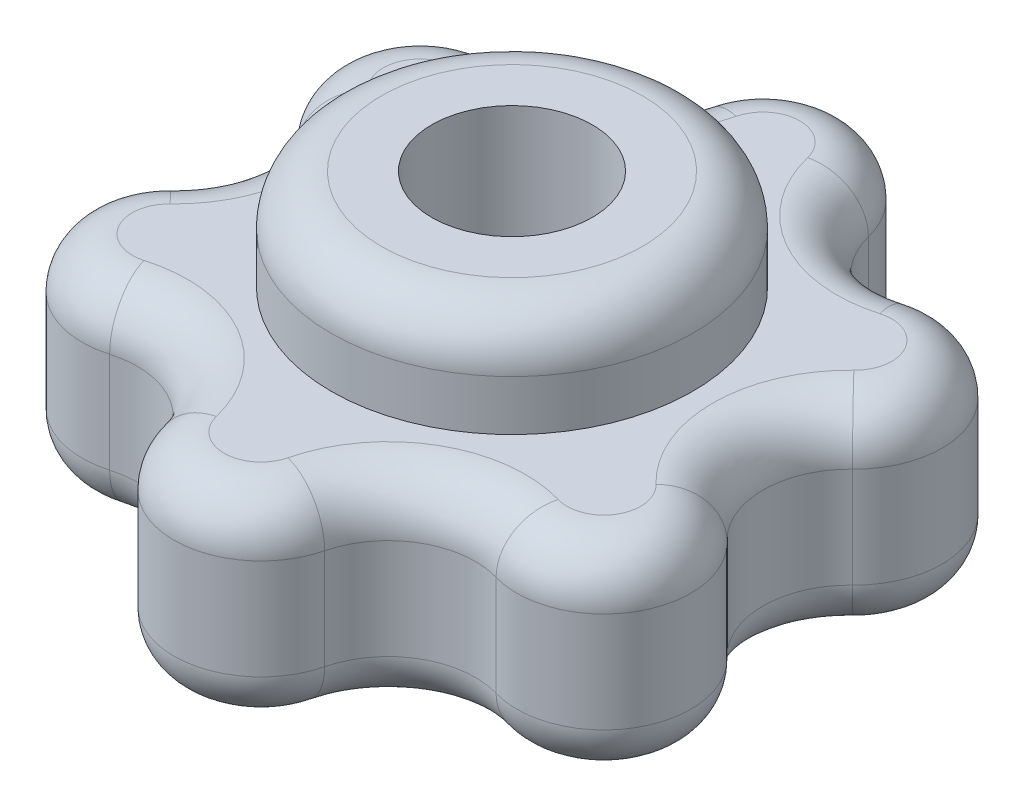
from build123d import *

# Parameters (mm, degrees)
EXTRUDE_1_DEPTH     = 4
SKETCH_2_R          = 3.6
EXTRUDE_2_DEPTH     = 2
SKETCH_3_R          = 1.6
CUT_EXTRUDE_1_DEPTH = 11.868526014
CUT_EXTRUDE_2_DEPTH = 2.5
FILLET_1_R          = 1


with BuildPart() as part:
    # Эскиз1 → Бобышка-Вытянуть1 (new body)
    with BuildSketch(Plane(origin=(0, 0, 0), x_dir=(1, 0, 0), z_dir=(0, 1, 0))):
        with BuildLine():
            ThreePointArc((1.683543611, 5.415983072), (0, 6.734174445), (-1.683543611, 5.415983072))
            ThreePointArc((-1.683543611, 5.415983072), (-2.5, 4.330127019), (-3.848607121, 4.165983072))
            ThreePointArc((-3.848607121, 4.165983072), (-5.831966143, 3.367087223), (-5.532150732, 1.25))
            ThreePointArc((-5.532150732, 1.25), (-5, 0), (-5.532150732, -1.25))
            ThreePointArc((-5.532150732, -1.25), (-5.831966143, -3.367087223), (-3.848607121, -4.165983072))
            ThreePointArc((-3.848607121, -4.165983072), (-2.5, -4.330127019), (-1.683543611, -5.415983072))
            ThreePointArc((-1.683543611, -5.415983072), (0, -6.734174445), (1.683543611, -5.415983072))
            ThreePointArc((1.683543611, -5.415983072), (2.5, -4.330127019), (3.848607121, -4.165983072))
            ThreePointArc((3.848607121, -4.165983072), (5.831966143, -3.367087223), (5.532150732, -1.25))
            ThreePointArc((5.532150732, -1.25), (5, 0), (5.532150732, 1.25))
            ThreePointArc((5.532150732, 1.25), (5.831966143, 3.367087223), (3.848607121, 4.165983072))
            ThreePointArc((3.848607121, 4.165983072), (2.5, 4.330127019), (1.683543611, 5.415983072))
        make_face()
    extrude(amount=EXTRUDE_1_DEPTH)

    # Эскиз2 → Бобышка-Вытянуть2 (add)
    with BuildSketch(Plane(origin=(0, 4, 0), x_dir=(1, 0, 0), z_dir=(0, 1, 0))):
        Circle(SKETCH_2_R)
    extrude(amount=EXTRUDE_2_DEPTH)

    # Эскиз3 → Вырез-Вытянуть1 (cut, through all)
    with BuildSketch(Plane(origin=(0, 6, 0), x_dir=(1, 0, 0), z_dir=(0, 1, 0))):
        Circle(SKETCH_3_R)
    extrude(amount=-CUT_EXTRUDE_1_DEPTH, mode=Mode.SUBTRACT)

    # Эскиз1<3> → Вырез-Вытянуть2 (cut)
    with BuildSketch(Plane(origin=(0, 0, 0), x_dir=(1, 0, 0), z_dir=(0, 1, 0))):
        Polygon((0, 3.348631561), (-2.9, 1.674315781), (-2.9, -1.674315781), (0, -3.348631561), (2.9, -1.674315781), (2.9, 1.674315781), align=None)
    extrude(amount=CUT_EXTRUDE_2_DEPTH, mode=Mode.SUBTRACT)

    # Скругление1
    fillet_1_edges = [part.edges().sort_by_distance(p)[0] for p in [
        (-2.5, 4, 4.330127019),
        (-5.831966143, 4, 3.367087223),
        (-5, 4, 0),
        (-5.831966143, 4, -3.367087223),
        (-2.5, 4, -4.330127019),
        (0, 4, -6.734174445),
        (2.5, 4, -4.330127019),
        (5.831966143, 4, -3.367087223),
        (5, 4, 0),
        (5.831966143, 4, 3.367087223),
        (2.5, 4, 4.330127019),
        (-2.5, 0, 4.330127019),
        (-5.831966143, 0, 3.367087223),
        (-5, 0, 0),
        (-5.831966143, 0, -3.367087223),
        (-2.5, 0, -4.330127019),
        (0, 0, -6.734174445),
        (2.5, 0, -4.330127019),
        (5.831966143, 0, -3.367087223),
        (5, 0, 0),
        (5.831966143, 0, 3.367087223),
        (2.5, 0, 4.330127019),
        (-3.6, 6, 0),
        (0, 4, 6.734174445),
        (0, 0, 6.734174445),
    ]]
    fillet(fillet_1_edges, radius=FILLET_1_R)


solid = part.part
